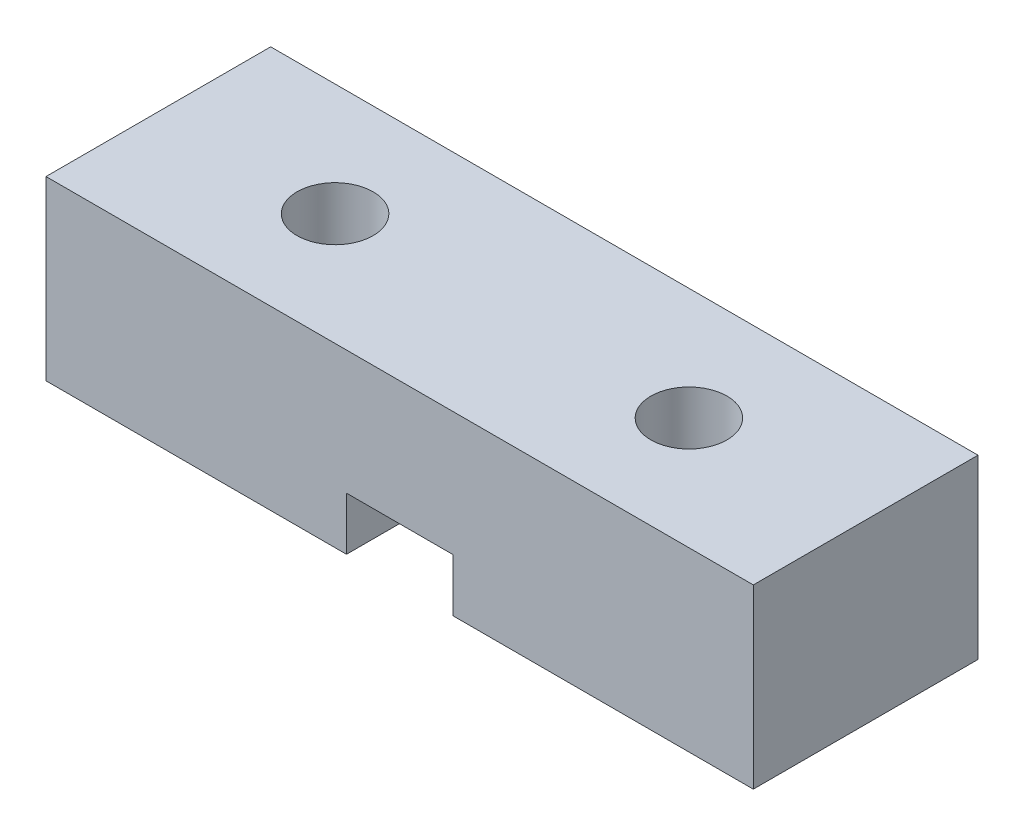
from build123d import *

# Parameters (mm, degrees)
BOSS_EXTRUDE1_DEPTH  = 12.7
M4_CLEARANCE_HOLE1_D = 4.3


with BuildPart() as part:
    # Sketch1 → Boss-Extrude1 (new body)
    with BuildSketch(Plane.XY):
        Polygon((54.99, 29.865), (15.01, 29.865), (15.01, 19.865), (31.995, 19.865), (31.995, 22.86), (38.005, 22.86), (38.005, 19.865), (54.99, 19.865), align=None)
    extrude(amount=-BOSS_EXTRUDE1_DEPTH)

    # M4 Clearance Hole1 (through all)
    with Locations(Plane(origin=(25, 19.865, -6.35), x_dir=(0, 0, -1), z_dir=(0, -1, 0))):
        with Locations((0, 0), (0, 20)):
            Hole(M4_CLEARANCE_HOLE1_D / 2)


solid = part.part
